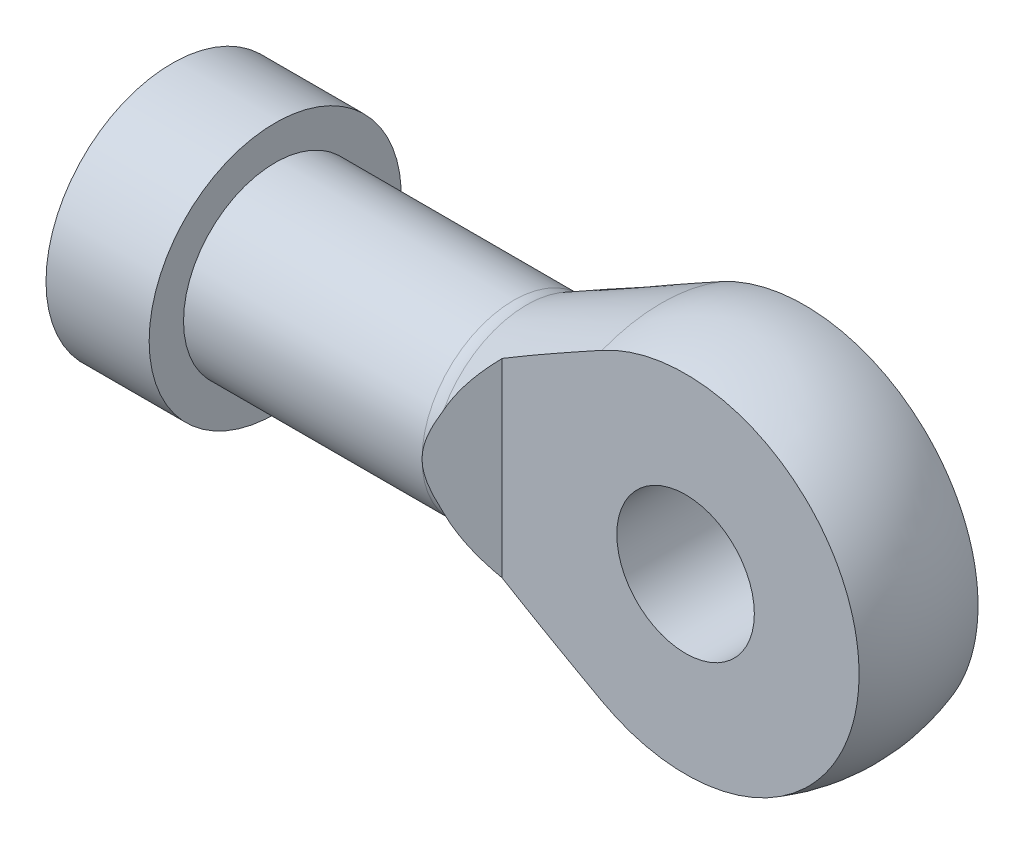
from build123d import *

# Parameters (mm, degrees)
CUT_EXTRUDE_1_DEPTH = 17.5
SKETCH_3_R          = 6
CUT_EXTRUDE_2_DEPTH = 30
SKETCH_4_R          = 6
CUT_EXTRUDE_3_DEPTH = 30


with BuildPart() as part:
    # 草图1 → 旋转1 (revolve)
    with BuildSketch(Plane(origin=(0, 0, 0), x_dir=(1, 0, 0), z_dir=(0, 1, 0)), mode=Mode.PRIVATE) as revolve_1_sk:
        with BuildLine():
            Line((0, 0), (0, 11))
            Line((0, 11), (9, 11))
            Line((9, 11), (9, 8))
            Line((9, 8), (29.811328827, 8))
            ThreePointArc((29.811328827, 8), (30.38898409, 8.056139542), (30.945019819, 8.222457069))
            Line((30.945019819, 8.222457069), (42.711427769, 14.243479731))
            ThreePointArc((42.711427769, 14.243479731), (58.348138844, 13.649490021), (66, 0))
            Line((66, 0), (0, 0))
        make_face()
    revolve(revolve_1_sk.sketch.rotate(Axis((0, 0, 0), (1, 0, 0)), 180), axis=Axis((0, 0, 0), (1, 0, 0)))

    # 草图2 → 拉伸1 (cut, symmetric)
    with BuildSketch(Plane(origin=(0, 0, 0), x_dir=(1, 0, 0), z_dir=(0, 1, 0))):
        Polygon((72.287262903, 20.406671453), (73.576090576, 5.191308691), (34, 5.191308691), (29.811328827, 8), (29.00979021, 16.150849151), align=None)
        Polygon((34, -5.191308691), (29.811328827, -8), (29.00979021, -16.150849151), (72.287262903, -20.406671453), (73.576090576, -5.191308691), align=None)
    extrude(amount=CUT_EXTRUDE_1_DEPTH, both=True, mode=Mode.SUBTRACT)

    # 草图3 → 拉伸2 (cut)
    with BuildSketch(Plane(origin=(0, 0, -5.191308691), x_dir=(-1, 0, 0), z_dir=(0, 0, -1))):
        with Locations((-50, 0)):
            Circle(SKETCH_3_R)
    extrude(amount=-CUT_EXTRUDE_2_DEPTH, mode=Mode.SUBTRACT)

    # 草图4 → 拉伸3 (cut)
    with BuildSketch(Plane.ZY):
        Circle(SKETCH_4_R)
    extrude(amount=-CUT_EXTRUDE_3_DEPTH, mode=Mode.SUBTRACT)


solid = part.part
